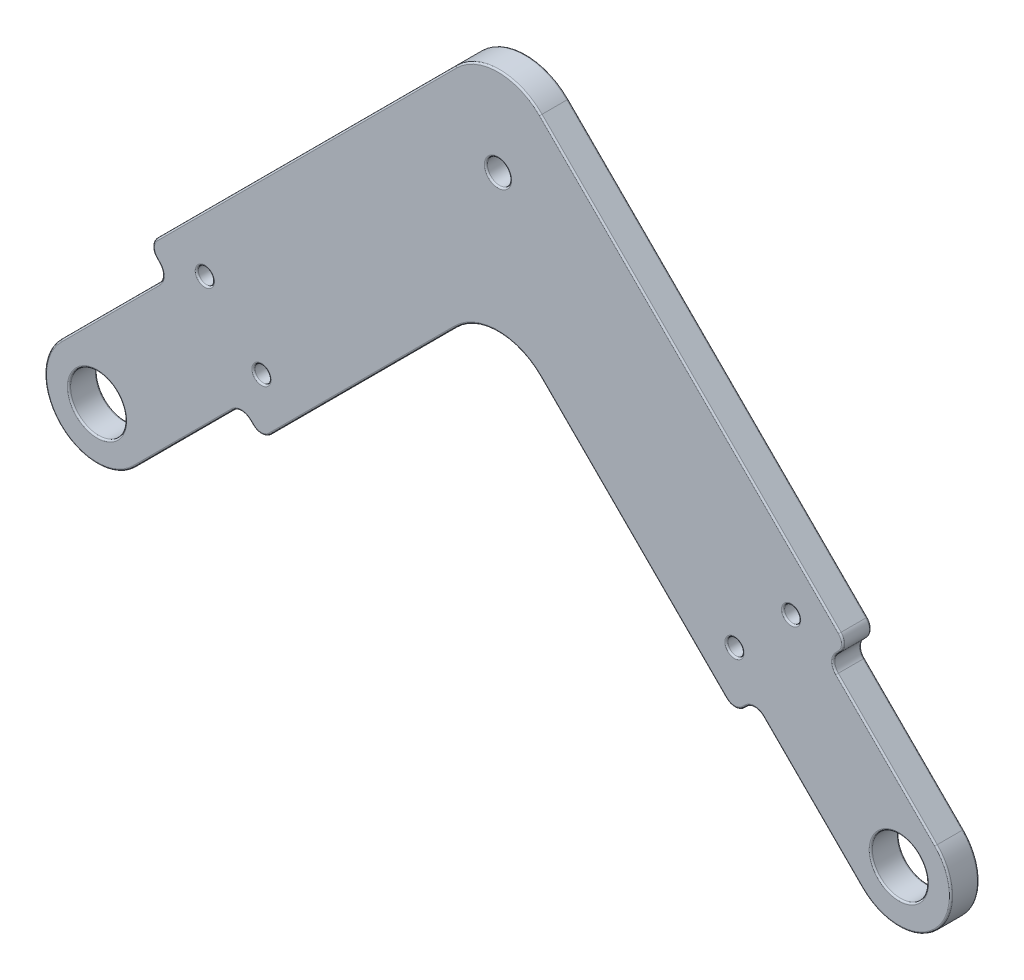
from build123d import *

# Parameters (mm, degrees)
SKETCH5_R           = 3.5
SKETCH5_R_2         = 1
SKETCH5_R_3         = 1.5
BOSS_EXTRUDE1_DEPTH = 3.5
FILLET1_R           = 7.5
FILLET2_R           = 1.5
FILLET3_R           = 0.2


with BuildPart() as part:
    # Sketch5 → Boss-Extrude1 (new body)
    with BuildSketch(Plane.XY):
        with BuildLine():
            Line((-95.403805922, -4.596194078), (-82.029390047, 8.778221797))
            Line((-82.029390047, 8.778221797), (-79.493903346, 6.363961031))
            Line((-79.493903346, 6.363961031), (-50, 35.857864376))
            Line((-50, 35.857864376), (-20.506096654, 6.363961031))
            Line((-20.506096654, 6.363961031), (-17.970609953, 8.778221797))
            Line((-17.970609953, 8.778221797), (-4.596194078, -4.596194078))
            ThreePointArc((-4.596194078, -4.596194078), (4.596194078, -4.596194078), (4.596194078, 4.596194078))
            Line((4.596194078, 4.596194078), (-8.778221797, 17.970609953))
            Line((-8.778221797, 17.970609953), (-6.363961031, 20.506096654))
            Line((-6.363961031, 20.506096654), (-50, 64.142135624))
            Line((-50, 64.142135624), (-93.636038969, 20.506096654))
            Line((-93.636038969, 20.506096654), (-91.221778203, 17.970609953))
            Line((-91.221778203, 17.970609953), (-104.596194078, 4.596194078))
            ThreePointArc((-104.596194078, 4.596194078), (-104.596194078, -4.596194078), (-95.403805922, -4.596194078))
        make_face()
        Circle(SKETCH5_R, mode=Mode.SUBTRACT)
        with Locations((-100, 0)):
            Circle(SKETCH5_R, mode=Mode.SUBTRACT)
        with Locations((-86.564971157, 20.506096654)):
            Circle(SKETCH5_R_2, mode=Mode.SUBTRACT)
        with Locations((-50, 50)):
            Circle(SKETCH5_R_3, mode=Mode.SUBTRACT)
        with Locations((-13.435028843, 20.506096654)):
            Circle(SKETCH5_R_2, mode=Mode.SUBTRACT)
        with Locations((-20.506096654, 13.435028843)):
            Circle(SKETCH5_R_2, mode=Mode.SUBTRACT)
        with Locations((-79.493903346, 13.435028843)):
            Circle(SKETCH5_R_2, mode=Mode.SUBTRACT)
    extrude(amount=BOSS_EXTRUDE1_DEPTH)

    # Fillet1
    fillet1_edges = [part.edges().sort_by_distance(p)[0] for p in [
        (-50, 64.142135624, 1.75),
        (-50, 35.857864376, 1.75),
    ]]
    fillet(fillet1_edges, radius=FILLET1_R)

    # Fillet2
    fillet2_edges = [part.edges().sort_by_distance(p)[0] for p in [
        (-93.636038969, 20.506096654, 1.75),
        (-6.363961031, 20.506096654, 1.75),
        (-8.778221797, 17.970609953, 1.75),
        (-17.970609953, 8.778221797, 1.75),
        (-20.506096654, 6.363961031, 1.75),
        (-79.493903346, 6.363961031, 1.75),
        (-82.029390047, 8.778221797, 1.75),
        (-91.221778203, 17.970609953, 1.75),
    ]]
    fillet(fillet2_edges, radius=FILLET2_R)

    # Fillet3
    fillet3_edges = [part.edges().sort_by_distance(p)[0] for p in [
        (-91.817552039, 17.977904508, 0),
        (-91.817552039, 17.977904508, 3.5),
        (-82.022095492, 8.182447961, 0),
        (-82.022095492, 8.182447961, 3.5),
        (-17.977904508, 8.182447961, 0),
        (-17.977904508, 8.182447961, 3.5),
        (-8.182447961, 17.977904508, 0),
        (-8.182447961, 17.977904508, 3.5),
        (-104.596194078, -4.596194078, 3.5),
        (-1.573513238, 10.765901393, 0),
        (4.596194078, -4.596194078, 0),
        (-89.234098607, 1.573513238, 3.5),
        (-89.234098607, 1.573513238, 0),
        (-104.596194078, -4.596194078, 0),
        (-3.5, 0, 0),
        (-3.5, 0, 3.5),
        (-103.5, 0, 0),
        (-103.5, 0, 3.5),
        (4.596194078, -4.596194078, 3.5),
        (-87.564971157, 20.506096654, 0),
        (-87.564971157, 20.506096654, 3.5),
        (-1.573513238, 10.765901393, 3.5),
        (-51.5, 50, 0),
        (-51.5, 50, 3.5),
        (-14.435028843, 20.506096654, 0),
        (-14.435028843, 20.506096654, 3.5),
        (-21.506096654, 13.435028843, 0),
        (-21.506096654, 13.435028843, 3.5),
        (-80.493903346, 13.435028843, 0),
        (-80.493903346, 13.435028843, 3.5),
        (-33.11889852, 18.976762896, 0),
        (-33.11889852, 18.976762896, 3.5),
        (-73.952169292, 40.189966331, 0),
        (-73.952169292, 40.189966331, 3.5),
        (-50, 61.035533906, 0),
        (-50, 61.035533906, 3.5),
        (-50, 32.751262658, 0),
        (-50, 32.751262658, 3.5),
        (-98.426486762, 10.765901393, 0),
        (-98.426486762, 10.765901393, 3.5),
        (-92.428908586, 19.238353304, 0),
        (-92.428908586, 19.238353304, 3.5),
        (-26.047830708, 40.189966331, 0),
        (-7.571091414, 19.238353304, 0),
        (-10.765901393, 1.573513238, 0),
        (-19.238353304, 7.571091414, 0),
        (-66.88110148, 18.976762896, 0),
        (-80.761646696, 7.571091414, 0),
        (-6.959734867, 20.498802099, 0),
        (-20.498802099, 6.959734867, 0),
        (-79.501197901, 6.959734867, 0),
        (-93.040265133, 20.498802099, 0),
        (-26.047830708, 40.189966331, 3.5),
        (-80.761646696, 7.571091414, 3.5),
        (-66.88110148, 18.976762896, 3.5),
        (-19.238353304, 7.571091414, 3.5),
        (-10.765901393, 1.573513238, 3.5),
        (-7.571091414, 19.238353304, 3.5),
        (-6.959734867, 20.498802099, 3.5),
        (-20.498802099, 6.959734867, 3.5),
        (-79.501197901, 6.959734867, 3.5),
        (-93.040265133, 20.498802099, 3.5),
    ]]
    fillet(fillet3_edges, radius=FILLET3_R)


solid = part.part
